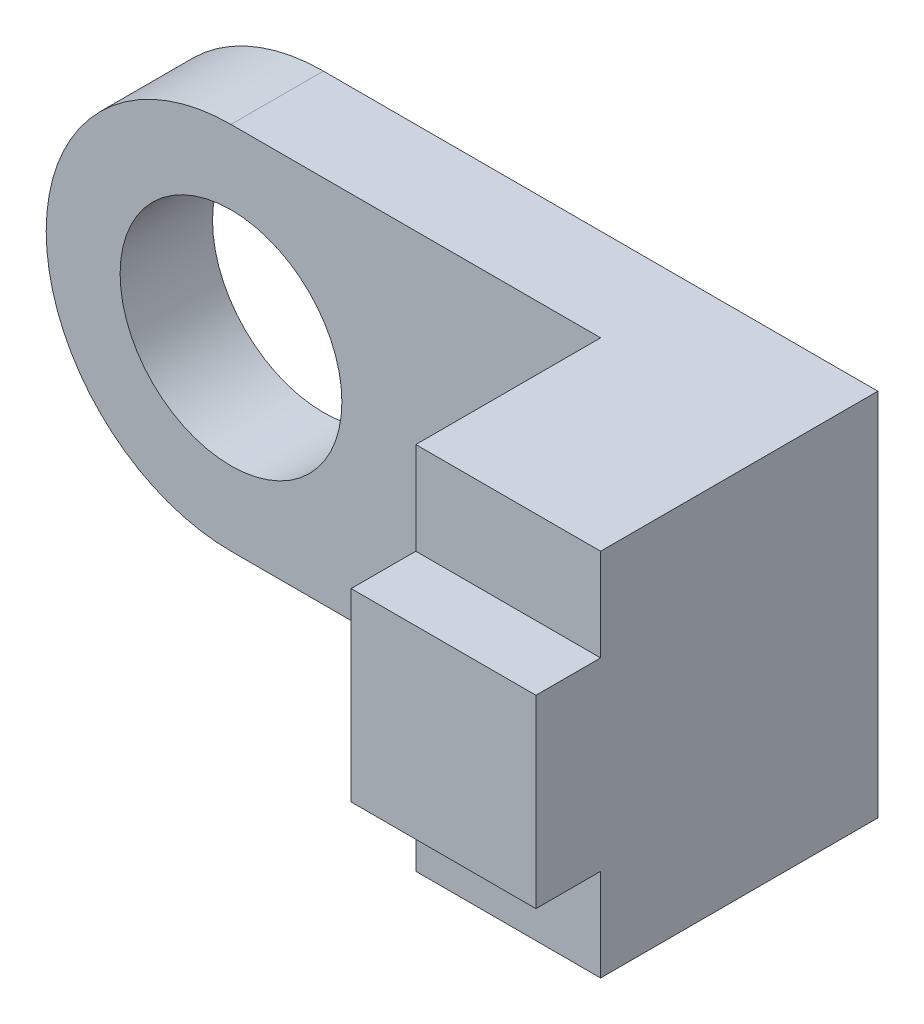
from build123d import *

# Parameters (mm, degrees)
SKETCH1_R           = 12
BOSS_EXTRUDE1_DEPTH = 10
SKETCH2_W           = 20
SKETCH2_H           = 40
BOSS_EXTRUDE2_DEPTH = 20
SKETCH3_W           = 20
SKETCH3_H           = 20
BOSS_EXTRUDE3_DEPTH = 7


with BuildPart() as part:
    # Sketch1 → Boss-Extrude1 (new body)
    with BuildSketch(Plane.XY):
        with BuildLine():
            Line((30, -20), (-30, -20))
            ThreePointArc((-30, -20), (-50, 0), (-30, 20))
            Line((-30, 20), (30, 20))
            Line((30, 20), (30, -20))
        make_face()
        with Locations((-30, 0)):
            Circle(SKETCH1_R, mode=Mode.SUBTRACT)
    extrude(amount=BOSS_EXTRUDE1_DEPTH)

    # Sketch2 → Boss-Extrude2 (add)
    with BuildSketch(Plane.XY.offset(10)):
        with Locations((20, 0)):
            Rectangle(SKETCH2_W, SKETCH2_H)
    extrude(amount=BOSS_EXTRUDE2_DEPTH)

    # Sketch3 → Boss-Extrude3 (add)
    with BuildSketch(Plane.XY.offset(30)):
        with Locations((20, 0)):
            Rectangle(SKETCH3_W, SKETCH3_H)
    extrude(amount=BOSS_EXTRUDE3_DEPTH)


solid = part.part
